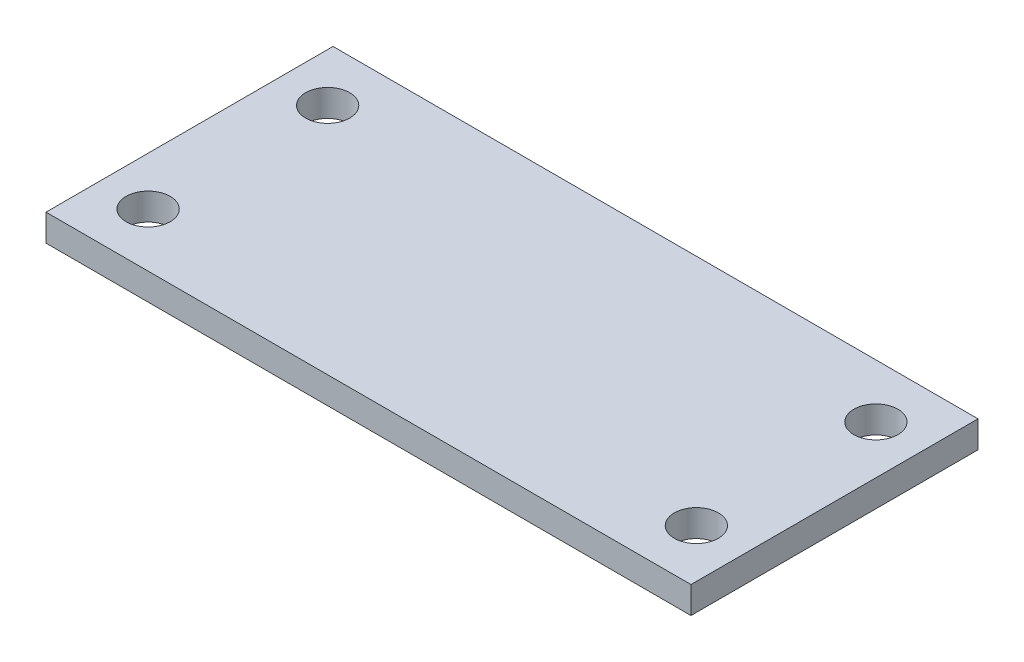
from build123d import *

# Parameters (mm, degrees)
ESQUISSE1_W        = 60
ESQUISSE1_H        = 26.7
ESQUISSE1_R        = 2.05
BOSS_EXTRU_1_DEPTH = 2.5


with BuildPart() as part:
    # Esquisse1 → Boss.-Extru.1 (new body)
    with BuildSketch(Plane(origin=(0, 0, 0), x_dir=(1, 0, 0), z_dir=(0, 1, 0))):
        Rectangle(ESQUISSE1_W, ESQUISSE1_H)
        with Locations(Location((-25.5, 8.35, 0), (0, 0, 270))):
            Circle(ESQUISSE1_R, mode=Mode.SUBTRACT)
        with Locations(Location((25.5, 8.35, 0), (0, 0, 90))):
            Circle(ESQUISSE1_R, mode=Mode.SUBTRACT)
        with Locations(Location((25.5, -8.35, 0), (0, 0, 270))):
            Circle(ESQUISSE1_R, mode=Mode.SUBTRACT)
        with Locations(Location((-25.5, -8.35, 0), (0, 0, 90))):
            Circle(ESQUISSE1_R, mode=Mode.SUBTRACT)
    extrude(amount=BOSS_EXTRU_1_DEPTH)


solid = part.part
